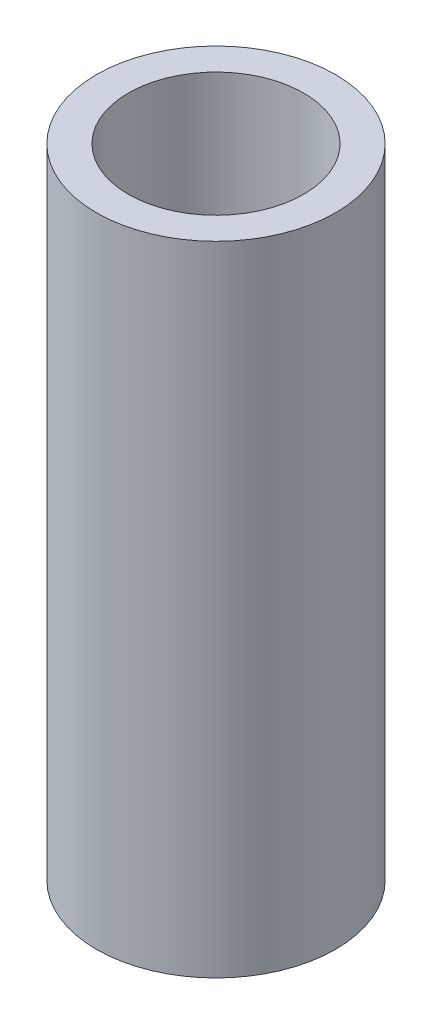
from build123d import *

# Parameters (mm, degrees)
SKETCH1_R           = 3.75
SKETCH1_R_2         = 2.75
BOSS_EXTRUDE1_DEPTH = 20


with BuildPart() as part:
    # Sketch1 → Boss-Extrude1 (new body)
    with BuildSketch(Plane(origin=(0, 0, 0), x_dir=(1, 0, 0), z_dir=(0, 1, 0))):
        with Locations(Location((0, 0, 0), (0, 0, 270))):
            Circle(SKETCH1_R)
        with Locations(Location((0, 0, 0), (0, 0, 270))):
            Circle(SKETCH1_R_2, mode=Mode.SUBTRACT)
    extrude(amount=BOSS_EXTRUDE1_DEPTH)


solid = part.part
